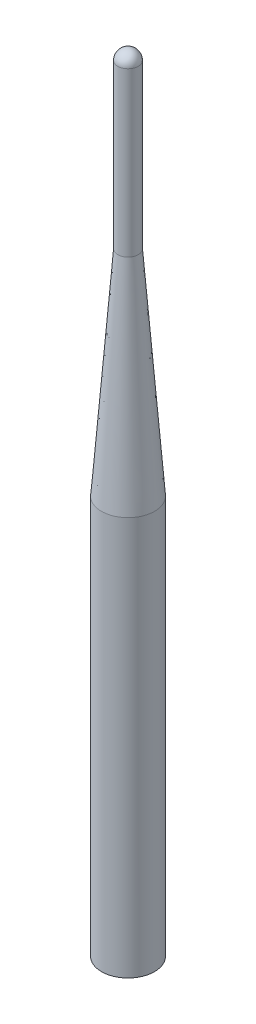
from build123d import *

# Parameters (mm, degrees)
SKETCH1_R           = 6.5
BOSS_EXTRUDE2_DEPTH = 22.75


with BuildPart() as part:
    # Sketch1 → Boss-Extrude2 (new body)
    with BuildSketch(Plane(origin=(0, 0, 0), x_dir=(1, 0, 0), z_dir=(0, 1, 0))):
        with Locations(Location((0, 0, 0), (0, 0, 270))):
            Circle(SKETCH1_R)
    extrude(amount=BOSS_EXTRUDE2_DEPTH)

    # Sketch2 → Revolve1 (revolve)
    with BuildSketch(Plane.XY, mode=Mode.PRIVATE) as revolve1_sk:
        with BuildLine():
            Line((0, 22.75), (-6.5, 22.75))
            Line((-6.5, 22.75), (-6.5, 97.75))
            Line((-6.5, 97.75), (-2.51, 150.25))
            Line((-2.51, 150.25), (-2.51, 190.25))
            ThreePointArc((-2.51, 190.25), (-1.777766953, 192.017766953), (-0.01, 192.75))
            Line((-0.01, 192.75), (0, 192.75))
            Line((0, 192.75), (0, 22.75))
        make_face()
    revolve(revolve1_sk.sketch.rotate(Axis((0, 22.75, 0), (0, 1, 0)), 270), axis=Axis((0, 22.75, 0), (0, 1, 0)))


solid = part.part
